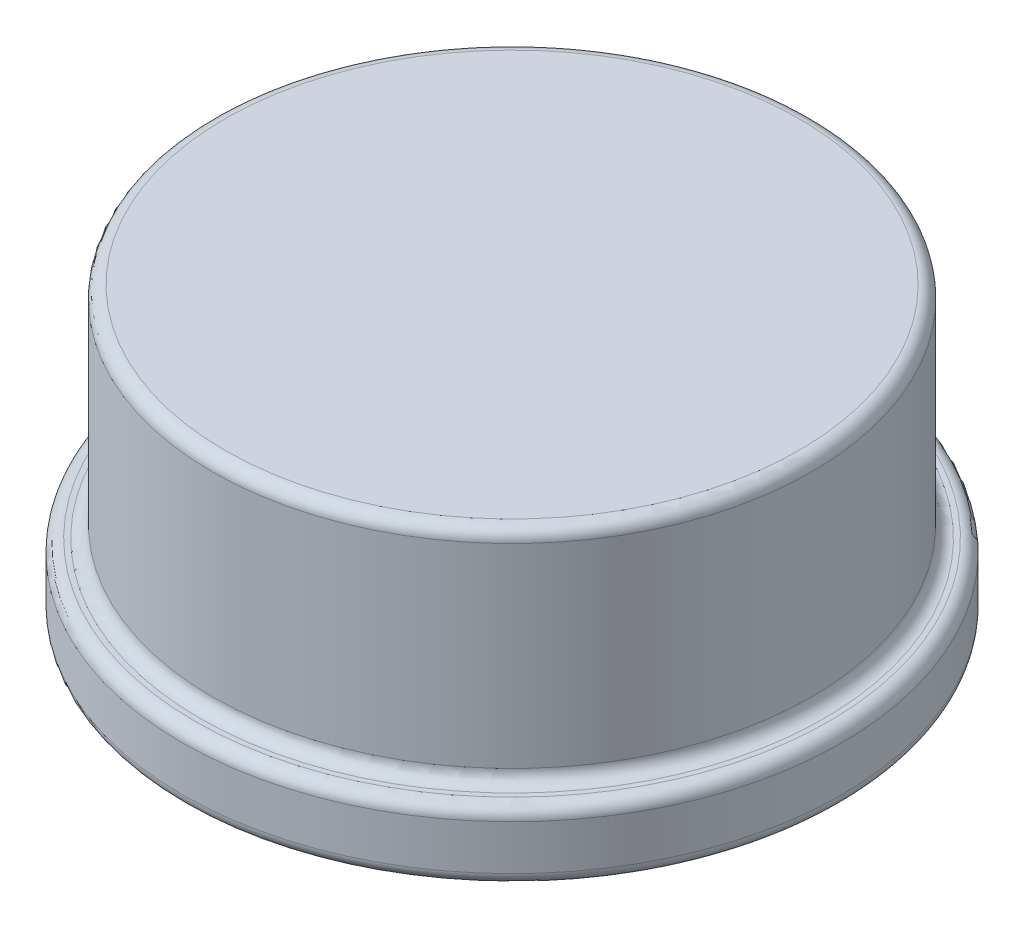
from build123d import *


with BuildPart() as part:
    # Sketch1 → Revolve1 (revolve)
    with BuildSketch(Plane(origin=(0, 0, 0), x_dir=(0, 0, -1), z_dir=(1, 0, 0))):
        with BuildLine():
            Line((0, 2.064150943), (-5.75, 2.064150943))
            ThreePointArc((-5.75, 2.064150943), (-5.926776695, 1.990927639), (-6, 1.814150943))
            Line((-6, 1.814150943), (-6, -2.085849057))
            ThreePointArc((-6, -2.085849057), (-6.073223305, -2.262625752), (-6.25, -2.335849057))
            Line((-6.25, -2.335849057), (-6.35, -2.335849057))
            ThreePointArc((-6.35, -2.335849057), (-6.526776695, -2.409072361), (-6.6, -2.585849057))
            Line((-6.6, -2.585849057), (-6.6, -3.485849057))
            ThreePointArc((-6.6, -3.485849057), (-6.526776695, -3.662625752), (-6.35, -3.735849057))
            Line((-6.35, -3.735849057), (-5.25, -3.735849057))
            ThreePointArc((-5.25, -3.735849057), (-5.073223305, -3.662625752), (-5, -3.485849057))
            Line((-5, -3.485849057), (-5, 0.814150943))
            ThreePointArc((-5, 0.814150943), (-4.926776695, 0.990927639), (-4.75, 1.064150943))
            Line((-4.75, 1.064150943), (0, 1.064150943))
            Line((0, 1.064150943), (0, 2.064150943))
        make_face()
    revolve(axis=Axis((0, 13.867924528, 0), (0, -1, 0)))


solid = part.part
